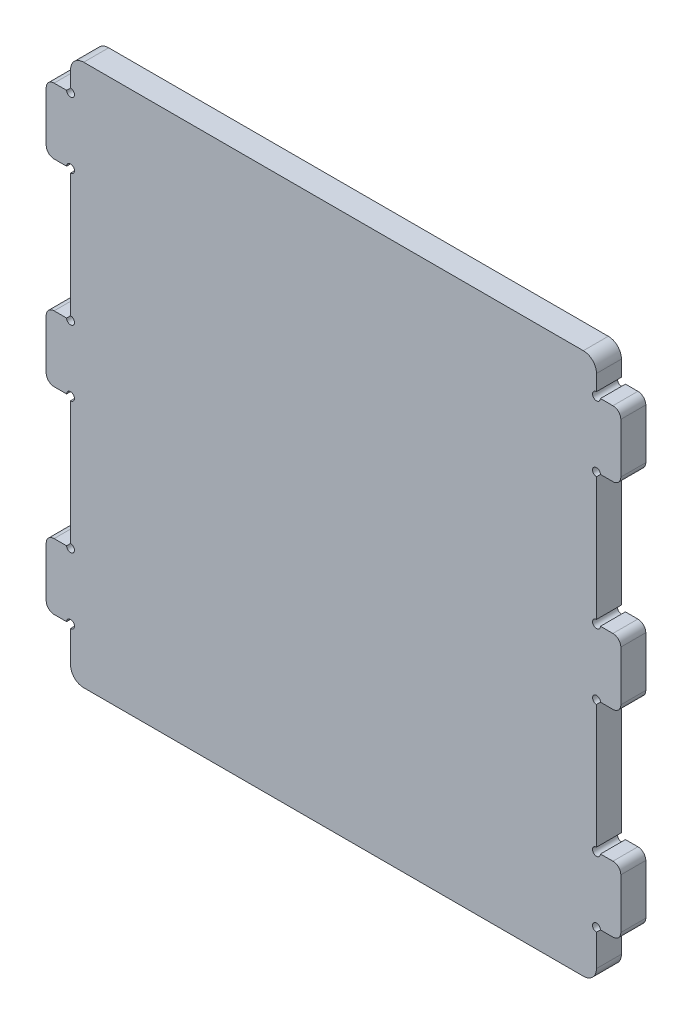
from build123d import *

# Parameters (mm, degrees)
BOSS_EXTRUDE1_DEPTH = 19


with BuildPart() as part:
    # Sketch1 → Boss-Extrude1 (new body)
    with BuildSketch(Plane.XY):
        with BuildLine():
            Line((-203, 31), (-212.5, 31))
            ThreePointArc((-212.5, 31), (-216.742640687, 29.242640687), (-218.5, 25))
            Line((-218.5, 25), (-218.5, -13))
            ThreePointArc((-218.5, -13), (-216.742640687, -17.242640687), (-212.5, -19))
            Line((-212.5, -19), (-203, -19))
            ThreePointArc((-203, -19), (-197.878679656, -16.878679656), (-200, -22))
            Line((-200, -22), (-200, -116))
            ThreePointArc((-200, -116), (-197.878679656, -121.121320344), (-203, -119))
            Line((-203, -119), (-212.5, -119))
            ThreePointArc((-212.5, -119), (-216.742640687, -120.757359313), (-218.5, -125))
            Line((-218.5, -125), (-218.5, -163))
            ThreePointArc((-218.5, -163), (-216.742640687, -167.242640687), (-212.5, -169))
            Line((-212.5, -169), (-203, -169))
            ThreePointArc((-203, -169), (-197.878679656, -166.878679656), (-200, -172))
            Line((-200, -172), (-200, -196))
            ThreePointArc((-200, -196), (-197.071067812, -203.071067812), (-190, -206))
            Line((-190, -206), (190, -206))
            ThreePointArc((190, -206), (197.071067812, -203.071067812), (200, -196))
            Line((200, -196), (200, -172))
            ThreePointArc((200, -172), (197.878679656, -166.878679656), (203, -169))
            Line((203, -169), (212.5, -169))
            ThreePointArc((212.5, -169), (216.742640687, -167.242640687), (218.5, -163))
            Line((218.5, -163), (218.5, -125))
            ThreePointArc((218.5, -125), (216.742640687, -120.757359313), (212.5, -119))
            Line((212.5, -119), (203, -119))
            ThreePointArc((203, -119), (197.878679656, -121.121320344), (200, -116))
            Line((200, -116), (200, -22))
            ThreePointArc((200, -22), (197.878679656, -16.878679656), (203, -19))
            Line((203, -19), (212.5, -19))
            ThreePointArc((212.5, -19), (216.742640687, -17.242640687), (218.5, -13))
            Line((218.5, -13), (218.5, 25))
            ThreePointArc((218.5, 25), (216.742640687, 29.242640687), (212.5, 31))
            Line((212.5, 31), (203, 31))
            ThreePointArc((203, 31), (197.878679656, 28.878679656), (200, 34))
            Line((200, 34), (200, 128))
            ThreePointArc((200, 128), (197.878679656, 133.121320344), (203, 131))
            Line((203, 131), (212.5, 131))
            ThreePointArc((212.5, 131), (216.742640687, 132.757359313), (218.5, 137))
            Line((218.5, 137), (218.5, 175))
            ThreePointArc((218.5, 175), (216.742640687, 179.242640687), (212.5, 181))
            Line((212.5, 181), (203, 181))
            ThreePointArc((203, 181), (197.878679656, 178.878679656), (200, 184))
            Line((200, 184), (200, 196))
            ThreePointArc((200, 196), (197.071067812, 203.071067812), (190, 206))
            Line((190, 206), (-190, 206))
            ThreePointArc((-190, 206), (-197.071067812, 203.071067812), (-200, 196))
            Line((-200, 196), (-200, 184))
            ThreePointArc((-200, 184), (-197.878679656, 178.878679656), (-203, 181))
            Line((-203, 181), (-212.5, 181))
            ThreePointArc((-212.5, 181), (-216.742640687, 179.242640687), (-218.5, 175))
            Line((-218.5, 175), (-218.5, 137))
            ThreePointArc((-218.5, 137), (-216.742640687, 132.757359313), (-212.5, 131))
            Line((-212.5, 131), (-203, 131))
            ThreePointArc((-203, 131), (-197.878679656, 133.121320344), (-200, 128))
            Line((-200, 128), (-200, 34))
            ThreePointArc((-200, 34), (-197.878679656, 28.878679656), (-203, 31))
        make_face()
    extrude(amount=BOSS_EXTRUDE1_DEPTH)


solid = part.part
